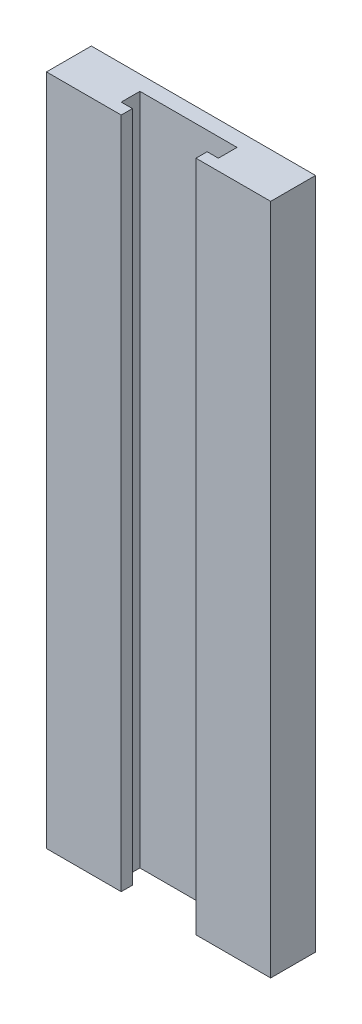
from build123d import *

# Parameters (mm, degrees)
SKETCH1_W           = 16
SKETCH1_H           = 90
BOSS_EXTRUDE1_DEPTH = 2
SKETCH2_W           = 1.5
SKETCH2_H           = 90
BOSS_EXTRUDE2_DEPTH = 4
SKETCH3_W           = 1.5
SKETCH3_H           = 90
BOSS_EXTRUDE3_DEPTH = 1.5
SKETCH4_W           = 1.5
SKETCH4_H           = 90
BOSS_EXTRUDE4_DEPTH = 1.5
SKETCH6_W           = 6
SKETCH6_H           = 90
BOSS_EXTRUDE5_DEPTH = 7
SKETCH7_W           = 6
SKETCH7_H           = 90
BOSS_EXTRUDE6_DEPTH = 7


with BuildPart() as part:
    # Sketch1 → Boss-Extrude1 (new body)
    with BuildSketch(Plane.XY):
        with Locations((0, -20)):
            Rectangle(SKETCH1_W, SKETCH1_H)
    extrude(amount=BOSS_EXTRUDE1_DEPTH)

    # Sketch2 → Boss-Extrude2 (add)
    with BuildSketch(Plane.XY.offset(2)):
        with Locations((-7.25, -20)):
            Rectangle(SKETCH2_W, SKETCH2_H)
        with Locations((7.25, -20)):
            Rectangle(SKETCH2_W, SKETCH2_H)
    extrude(amount=BOSS_EXTRUDE2_DEPTH)

    # Sketch3 → Boss-Extrude3 (add)
    with BuildSketch(Plane(origin=(-6.5, 0, 0), x_dir=(0, 0, -1), z_dir=(1, 0, 0))):
        with Locations((-5.25, -20)):
            Rectangle(SKETCH3_W, SKETCH3_H)
    extrude(amount=BOSS_EXTRUDE3_DEPTH)

    # Sketch4 → Boss-Extrude4 (add)
    with BuildSketch(Plane.ZY.offset(-6.5)):
        with Locations((5.25, -20)):
            Rectangle(SKETCH4_W, SKETCH4_H)
    extrude(amount=BOSS_EXTRUDE4_DEPTH)

    # Sketch6 → Boss-Extrude5 (add)
    with BuildSketch(Plane(origin=(8, 0, 0), x_dir=(0, 0, -1), z_dir=(1, 0, 0))):
        with Locations((-3, -20)):
            Rectangle(SKETCH6_W, SKETCH6_H)
    extrude(amount=BOSS_EXTRUDE5_DEPTH)

    # Sketch7 → Boss-Extrude6 (add)
    with BuildSketch(Plane.ZY.offset(8)):
        with Locations((3, -20)):
            Rectangle(SKETCH7_W, SKETCH7_H)
    extrude(amount=BOSS_EXTRUDE6_DEPTH)


solid = part.part
